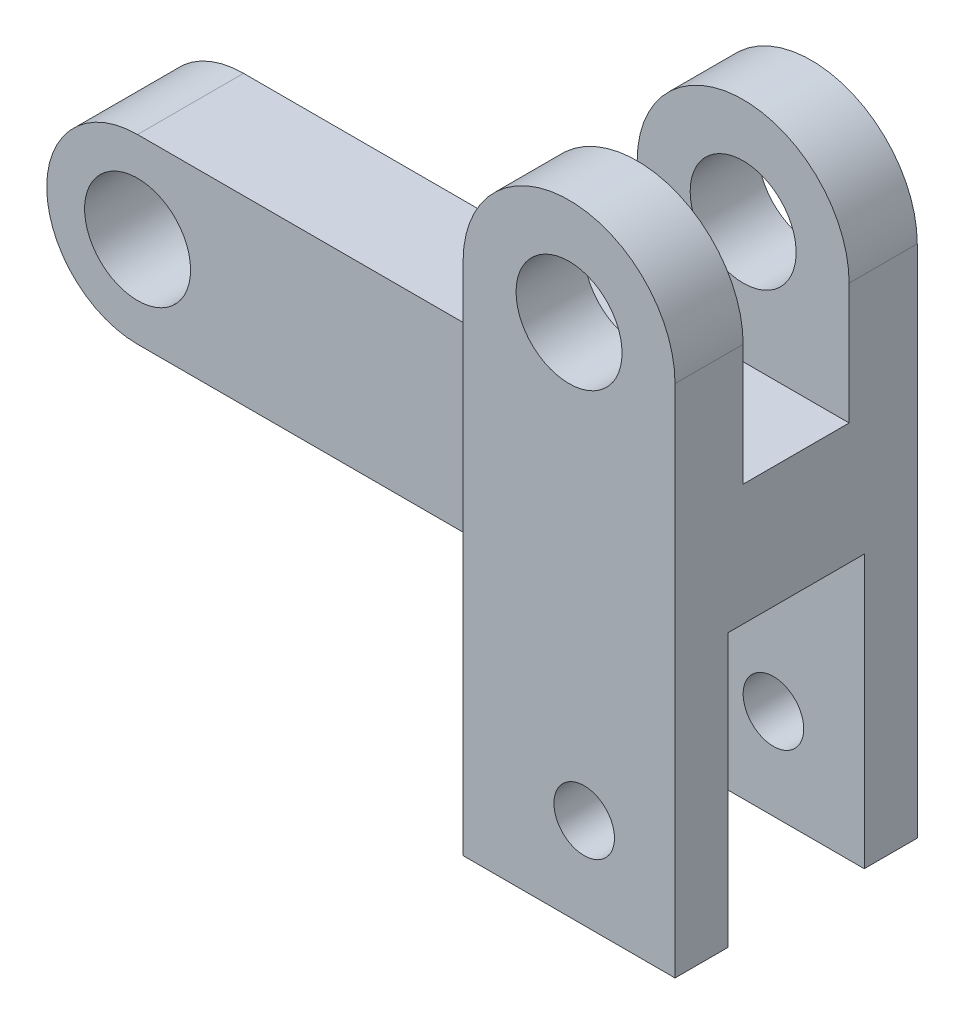
from build123d import *
from build123d.topology import SkipClean

# Parameters (mm, degrees)
SKETCH_1_W          = 7
SKETCH_1_H          = 7
EXTRUDE_1_DEPTH     = 2.4
EXTRUDE_6_DEPTH     = 1.75
EXTRUDE_START       = -5.25
EXTRUDE_8_DEPTH     = 1.75
SKETCH_11_R         = 1.75
CUT_EXTRUDE_1_DEPTH = 17.740669043
SKETCH_17_W         = 7
SKETCH_17_H         = 7
EXTRUDE_10_DEPTH    = 7
SKETCH_15_R         = 1.75
EXTRUDE_9_DEPTH     = 1.75
SKETCH_12_R         = 1
CUT_EXTRUDE_2_DEPTH = 21.639767441
SKETCH_18_W         = 7
SKETCH_18_H         = 4.5
CUT_EXTRUDE_4_DEPTH = 9
SKETCH_19_R         = 1
SKETCH_19_R_2       = 1.75
EXTRUDE_11_DEPTH    = 0.5
EXTRUDE_START_2     = 0.5
SKETCH_20_R         = 1
SKETCH_20_R_2       = 1.75
EXTRUDE_12_DEPTH    = 0.5


with BuildPart() as part:
    # 草图1 → 凸台-拉伸1 (new body)
    with BuildSketch(Plane(origin=(0, 0, 0), x_dir=(1, 0, 0), z_dir=(0, 1, 0))):
        with Locations((3.5, 0)):
            Rectangle(SKETCH_1_W, SKETCH_1_H)
    extrude(amount=EXTRUDE_1_DEPTH)

    # 草图10 → 凸台-拉伸6 (add)
    with BuildSketch(Plane(origin=(0, 0, -3.5), x_dir=(-1, 0, 0), z_dir=(0, 0, -1))):
        with BuildLine():
            Line((-7, 10), (-7, 2.4))
            Line((-7, 2.4), (0, 2.4))
            Line((0, 2.4), (0, 10))
            ThreePointArc((0, 10), (-3.5, 13.5), (-7, 10))
        make_face()
    extrude(amount=-EXTRUDE_6_DEPTH)

    # 草图10<2> → 凸台-拉伸8 (add)
    with BuildSketch(Plane(origin=(0, 0, -3.5), x_dir=(-1, 0, 0), z_dir=(0, 0, -1)).offset(EXTRUDE_START)):
        with BuildLine():
            Line((-7, 10), (-7, 2.4))
            Line((-7, 2.4), (0, 2.4))
            Line((0, 2.4), (0, 10))
            ThreePointArc((0, 10), (-3.5, 13.5), (-7, 10))
        make_face()
    extrude(amount=-EXTRUDE_8_DEPTH)

    # 草图11 → 切除-拉伸1 (cut, through all)
    with BuildSketch(Plane(origin=(0, 0, -3.5), x_dir=(-1, 0, 0), z_dir=(0, 0, -1))):
        with Locations((-3.5, 10)):
            Circle(SKETCH_11_R)
    extrude(amount=-CUT_EXTRUDE_1_DEPTH, mode=Mode.SUBTRACT)

    # 草图17 → 凸台-拉伸10 (add)
    with BuildSketch(Plane.XZ):
        with Locations((3.5, 0)):
            Rectangle(SKETCH_17_W, SKETCH_17_H)
    extrude(amount=EXTRUDE_10_DEPTH)

    # 草图15 → 凸台-拉伸9 (add, symmetric)
    with BuildSketch(Plane.XY):
        with BuildLine():
            Line((7, 2.4), (7, 6))
            Line((7, 6), (-13, 6))
            ThreePointArc((-13, 6), (-16, 3), (-13, 0))
            Line((-13, 0), (7, 0))
            Line((7, 0), (7, 2.4))
        make_face()
        with Locations((-13, 3)):
            Circle(SKETCH_15_R, mode=Mode.SUBTRACT)
    extrude(amount=EXTRUDE_9_DEPTH, both=True)

    # 草图12 → 切除-拉伸2 (cut, through all)
    with BuildSketch(Plane(origin=(0, 4, 3.5), x_dir=(1, 0, 0), z_dir=(0, 0, -1))):
        with Locations((4, 8)):
            Circle(SKETCH_12_R)
    extrude(amount=CUT_EXTRUDE_2_DEPTH, mode=Mode.SUBTRACT)

    # 草图18 → 切除-拉伸4 (cut)
    with BuildSketch(Plane(origin=(7.4, -7, 0), x_dir=(1, 0, 0), z_dir=(0, 1, 0))):
        with Locations((-3.9, 0)):
            Rectangle(SKETCH_18_W, SKETCH_18_H)
    extrude(amount=CUT_EXTRUDE_4_DEPTH, mode=Mode.SUBTRACT)

    # 草图19 → 凸台-拉伸11 (add)
    with SkipClean():  # the faces are left unmerged after this step: merging them gives an invalid solid
        with BuildSketch(Plane.XY.offset(3.5)):
            with BuildLine():
                Line((0, 10), (0, -7))
                Line((0, -7), (7, -7))
                Line((7, -7), (7, 10))
                ThreePointArc((7, 10), (3.5, 13.5), (0, 10))
            make_face()
            with Locations((4, -4)):
                Circle(SKETCH_19_R, mode=Mode.SUBTRACT)
            with Locations((3.5, 10)):
                Circle(SKETCH_19_R_2, mode=Mode.SUBTRACT)
        extrude(amount=EXTRUDE_11_DEPTH)

    # 草图20 → 凸台-拉伸12 (add)
    with SkipClean():  # the faces are left unmerged after this step: merging them gives an invalid solid
        with BuildSketch(Plane(origin=(0, 0, -3.5), x_dir=(-1, 0, 0), z_dir=(0, 0, -1)).offset(EXTRUDE_START_2)):
            with BuildLine():
                Line((-7, 10), (-7, -7))
                Line((-7, -7), (0, -7))
                Line((0, -7), (0, 10))
                ThreePointArc((0, 10), (-3.5, 13.5), (-7, 10))
            make_face()
            with Locations((-4, -4)):
                Circle(SKETCH_20_R, mode=Mode.SUBTRACT)
            with Locations((-3.5, 10)):
                Circle(SKETCH_20_R_2, mode=Mode.SUBTRACT)
        extrude(amount=-EXTRUDE_12_DEPTH)


solid = part.part
